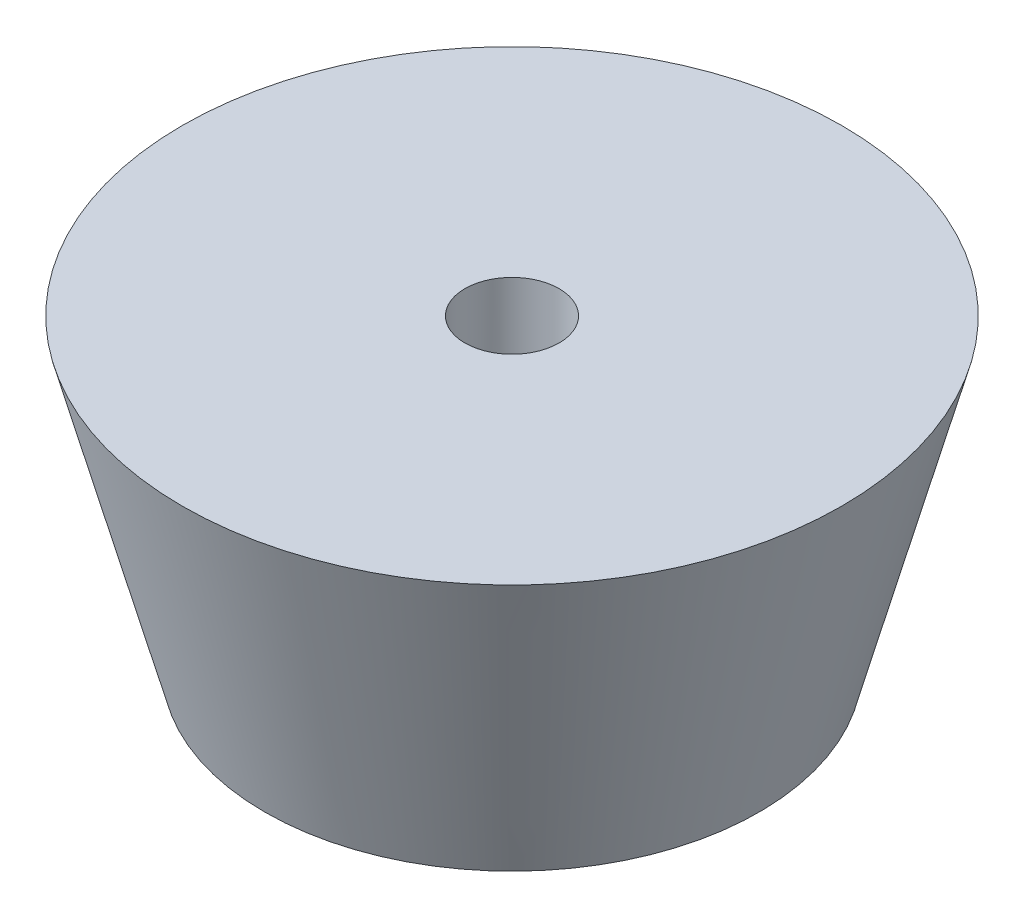
from build123d import *

# Parameters (mm, degrees)
SKETCH_2_R          = 14
SKETCH_1_R          = 10.5
SKETCH_3_R          = 6.5
CUT_EXTRUDE_1_DEPTH = 10
SKETCH_4_R          = 2
CUT_EXTRUDE_2_DEPTH = 23.181073184


with BuildPart() as part:
    # Эскиз2 → По сечениям1 section 0
    with BuildSketch(Plane(origin=(0, 13, 0), x_dir=(1, 0, 0), z_dir=(0, 1, 0))):
        Circle(SKETCH_2_R)
    # Эскиз1 → По сечениям1 section 1
    with BuildSketch(Plane(origin=(0, 0, 0), x_dir=(1, 0, 0), z_dir=(0, 1, 0))):
        Circle(SKETCH_1_R)
    loft()

    # Эскиз3 → Вырез-Вытянуть1 (cut)
    with BuildSketch(Plane.XZ):
        with Locations(Location((0, 0, 0), (0, 0, 270))):
            Circle(SKETCH_3_R)
    extrude(amount=-CUT_EXTRUDE_1_DEPTH, mode=Mode.SUBTRACT)

    # Эскиз4 → Вырез-Вытянуть2 (cut, through all)
    with BuildSketch(Plane.XZ.offset(-10)):
        with Locations(Location((0, 0, 0), (0, 0, 270))):
            Circle(SKETCH_4_R)
    extrude(amount=-CUT_EXTRUDE_2_DEPTH, mode=Mode.SUBTRACT)


solid = part.part
